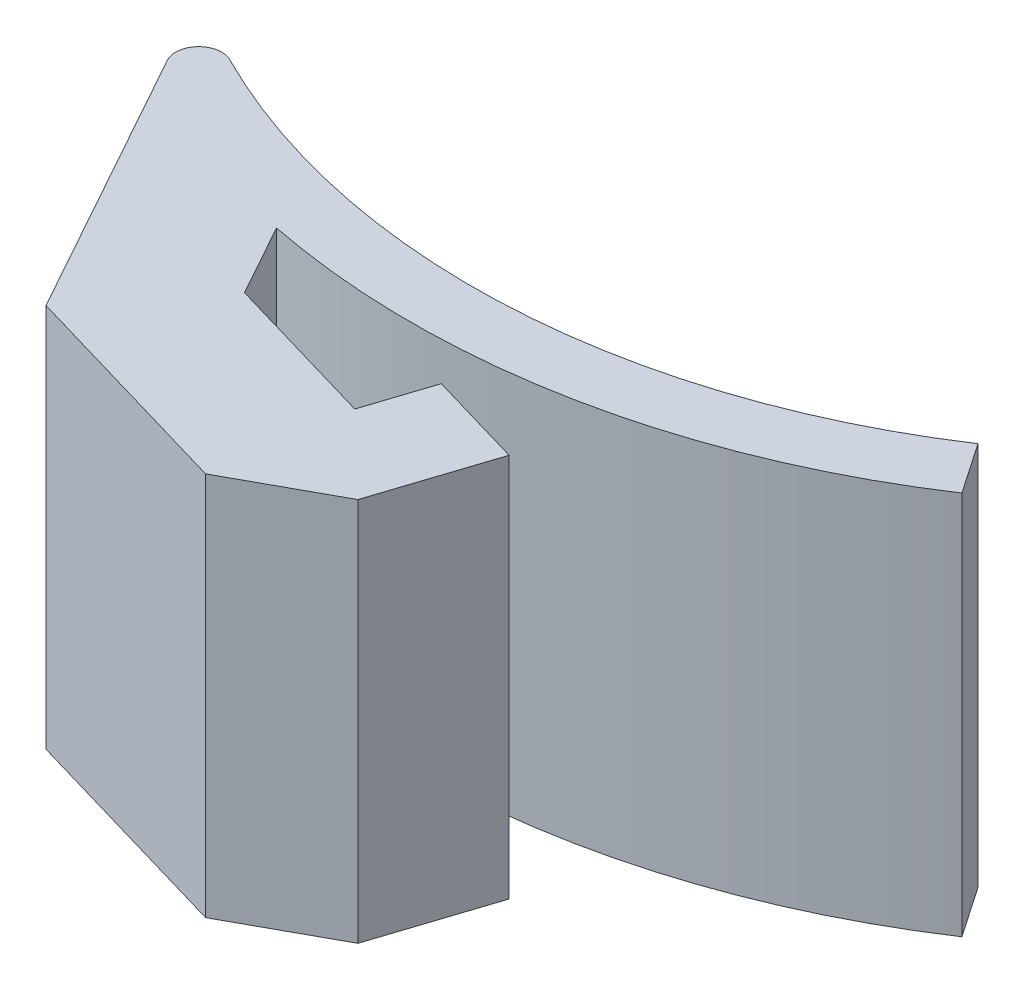
from build123d import *

# Parameters (mm, degrees)
EXTRUDE_1_DEPTH = 5
CHAMFER_1_SIZE  = 1
CHAMFER_1_SIZE2 = 1.032395136


with BuildPart() as part:
    # Эскиз1 → Бобышка-Вытянуть1 (new body)
    with BuildSketch(Plane(origin=(0, 0, 0), x_dir=(1, 0, 0), z_dir=(0, 1, 0))):
        with BuildLine():
            Line((2.5, -4.5), (6.395063253, -5.64))
            Line((6.395063253, -5.64), (7.2, -3.175018115))
            Line((7.2, -3.175018115), (5.952339772, -2.809855198))
            Line((5.952339772, -2.809855198), (5.675364666, -3.658044352))
            Line((5.675364666, -3.658044352), (3.647199382, -3.06444464))
            Line((3.647199382, -3.06444464), (3.126833621, -2.12778627))
            ThreePointArc((3.126833621, -2.12778627), (6.994242164, -2.125926125), (10.57111662, -0.655272725))
            Line((10.57111662, -0.655272725), (10.119998501, 0.005508219))
            ThreePointArc((10.119998501, 0.005508219), (5.594481852, -1.5), (0.923871938, -0.534464416))
            ThreePointArc((0.923871938, -0.534464416), (0.572572084, -0.594660683), (0.526733755, -0.948120759))
            Line((0.526733755, -0.948120759), (2.5, -4.5))
        make_face()
    extrude(amount=EXTRUDE_1_DEPTH)

    # Фаска1
    chamfer_1_edges = [part.edges().sort_by_distance(p)[0] for p in [
        (6.395063253, 2.5, 5.64),
    ]]
    chamfer_1_side = [part.faces().sort_by_distance(p)[0] for p in [
        (4.447531626, 2.5, 5.07),
    ]]
    chamfer(chamfer_1_edges, length=CHAMFER_1_SIZE, length2=CHAMFER_1_SIZE2, reference=chamfer_1_side[0])


solid = part.part
